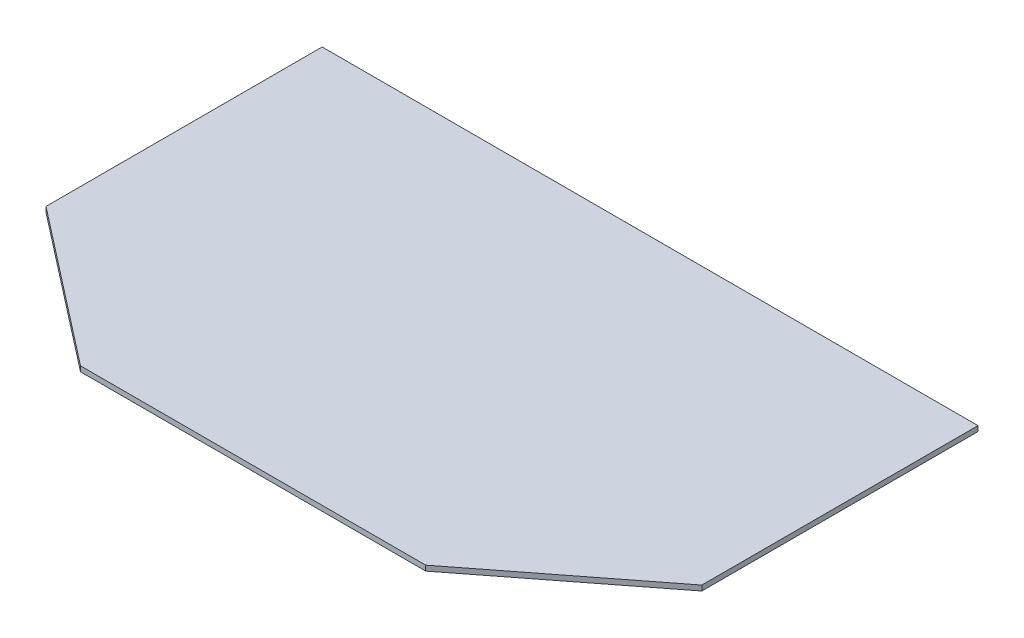
from build123d import *

# Parameters (mm, degrees)
BOSS_EXTRUDE1_DEPTH = 3


with BuildPart() as part:
    # Sketch1 → Boss-Extrude1 (new body)
    with BuildSketch(Plane(origin=(0, 0, 0), x_dir=(1, 0, 0), z_dir=(0, 1, 0))):
        Polygon((-190, 80), (190, 80), (190, 60), (190, -60), (190, -80), (100, -150), (-100, -150), (-190, -80), (-190, -60), (-190, 60), align=None)
    extrude(amount=BOSS_EXTRUDE1_DEPTH)


solid = part.part
